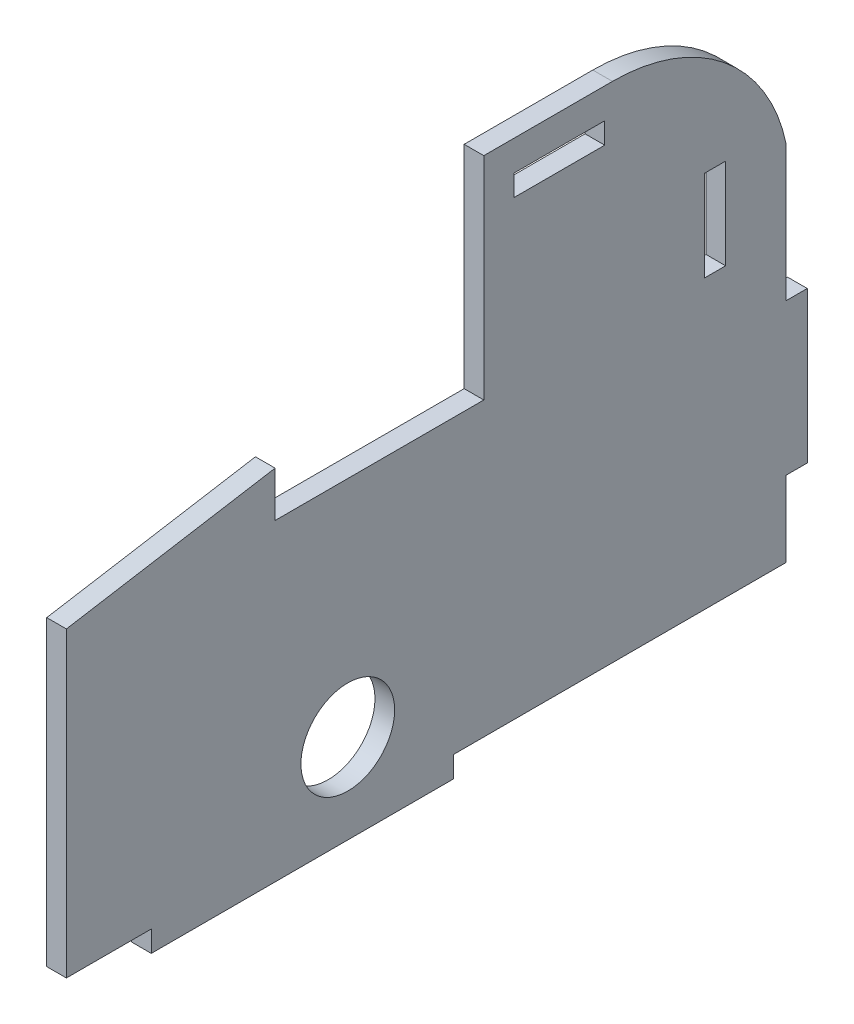
from build123d import *

# Parameters (mm, degrees)
BOSS_EXTRUDE1_DEPTH = 1.3
SKETCH2_W           = 20
SKETCH2_H           = 1.4
SKETCH2_W_2         = 1.4
SKETCH2_H_2         = 10
BOSS_EXTRUDE2_DEPTH = 1.3
SKETCH3_W           = 6
SKETCH3_H           = 1.4
SKETCH3_W_2         = 1.4
SKETCH3_H_2         = 6
CUT_EXTRUDE1_DEPTH  = 46.678384543
SKETCH4_R           = 3.1
CUT_EXTRUDE2_DEPTH  = 46.678384543


with BuildPart() as part:
    # Sketch1 → Boss-Extrude1 (new body)
    with BuildSketch(Plane(origin=(0, 0, 0), x_dir=(0, 0, -1), z_dir=(1, 0, 0))):
        with BuildLine():
            Line((-31.228581667, 0), (-31.228581667, 20))
            Line((-31.228581667, 20), (-17.420583246, 22.310666482))
            Line((-17.420583246, 22.310666482), (-17.420583246, 19.310666482))
            Line((-17.420583246, 19.310666482), (-3.612584824, 19.310666482))
            Line((-3.612584824, 19.310666482), (-3.612584824, 33.310666482))
            Line((-3.612584824, 33.310666482), (4.898619689, 33.310666482))
            ThreePointArc((4.898619689, 33.310666482), (12.292551865, 30.690758286), (16.387415176, 24))
            Line((16.387415176, 24), (16.387415176, 0))
            Line((16.387415176, 0), (0, 0))
            Line((0, 0), (-31.228581667, 0))
        make_face()
    extrude(amount=BOSS_EXTRUDE1_DEPTH)

    # Sketch2 → Boss-Extrude2 (add)
    with BuildSketch(Plane(origin=(1.3, 0, 0), x_dir=(0, 0, -1), z_dir=(1, 0, 0))):
        with Locations((-15.612584824, -0.7)):
            Rectangle(SKETCH2_W, SKETCH2_H)
        with Locations((17.087415176, 10)):
            Rectangle(SKETCH2_W_2, SKETCH2_H_2)
    extrude(amount=-BOSS_EXTRUDE2_DEPTH)

    # Sketch3 → Cut-Extrude1 (cut, through all)
    with BuildSketch(Plane(origin=(1.3, 0, 0), x_dir=(0, 0, -1), z_dir=(1, 0, 0))):
        with Locations((1.387415176, 30.610666482)):
            Rectangle(SKETCH3_W, SKETCH3_H)
        with Locations((11.687415176, 22)):
            Rectangle(SKETCH3_W_2, SKETCH3_H_2)
    extrude(amount=-CUT_EXTRUDE1_DEPTH, mode=Mode.SUBTRACT)

    # Sketch4 → Cut-Extrude2 (cut, through all)
    with BuildSketch(Plane(origin=(1.3, 0, 0), x_dir=(0, 0, -1), z_dir=(1, 0, 0))):
        with Locations((-12.612584824, 4.5)):
            Circle(SKETCH4_R)
    extrude(amount=-CUT_EXTRUDE2_DEPTH, mode=Mode.SUBTRACT)


solid = part.part
